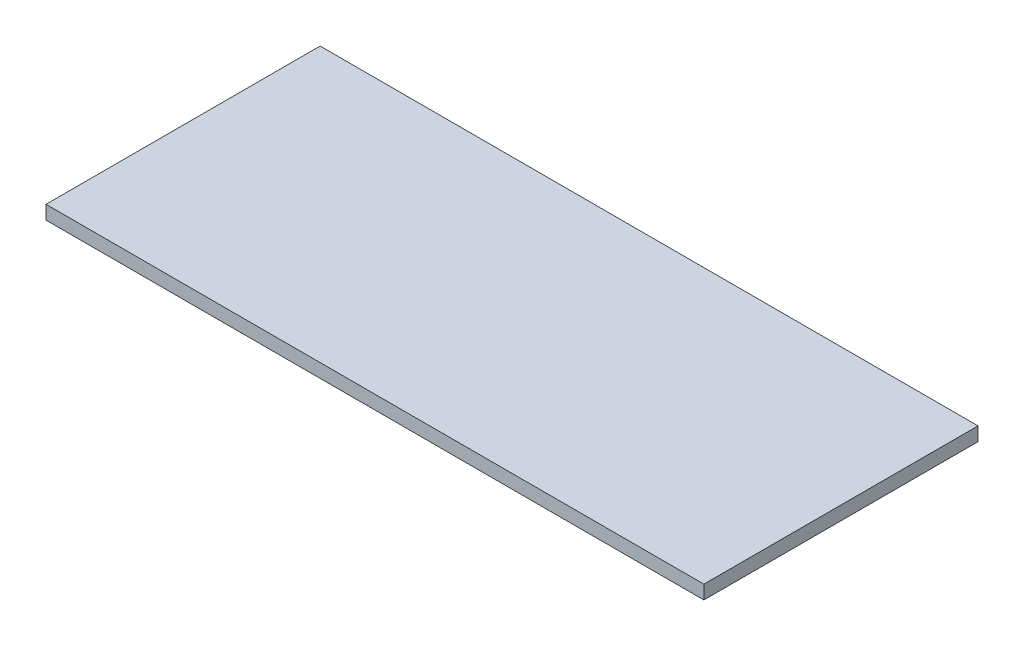
from build123d import *

# Parameters (mm, degrees)
SKETCH1_W           = 240
SKETCH1_H           = 5
BOSS_EXTRUDE1_DEPTH = 100


with BuildPart() as part:
    # Sketch1 → Boss-Extrude1 (new body)
    with BuildSketch(Plane.XY):
        with Locations((120, 2.5)):
            Rectangle(SKETCH1_W, SKETCH1_H)
    extrude(amount=BOSS_EXTRUDE1_DEPTH)


solid = part.part
